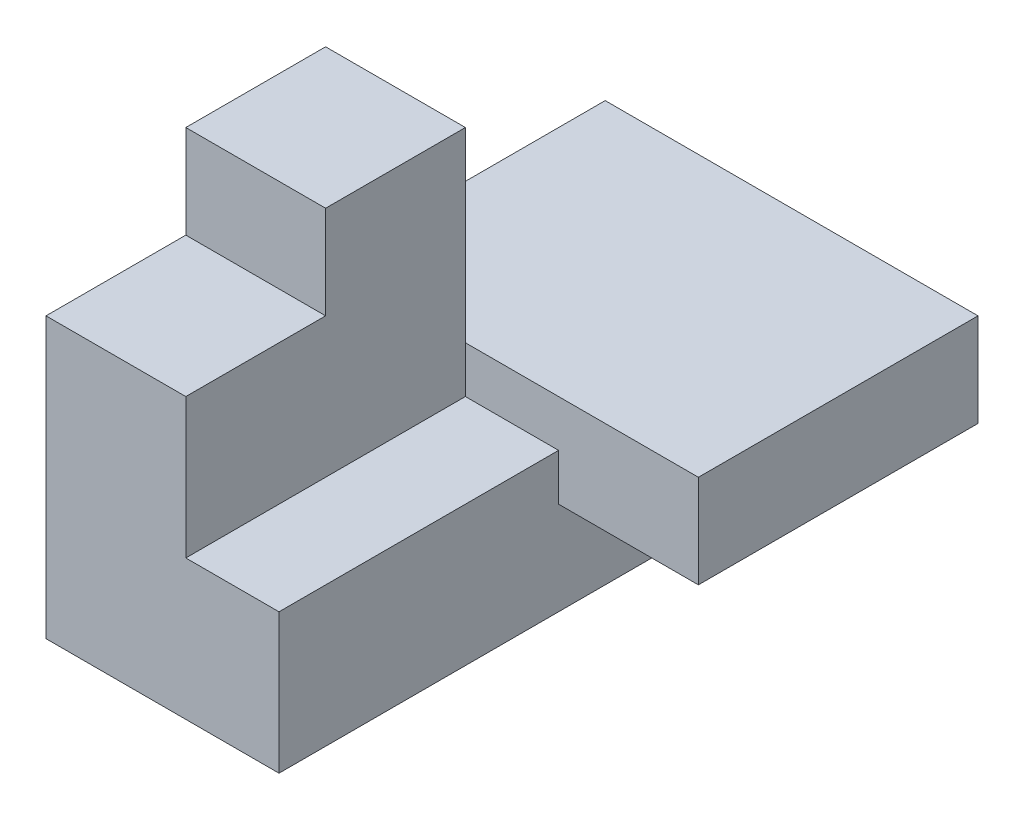
from build123d import *

# Parameters (mm, degrees)
SKETCH1_W           = 40
SKETCH1_H           = 40
BOSS_EXTRUDE1_DEPTH = 60
SKETCH2_W           = 20
SKETCH2_H           = 40
CUT_EXTRUDE1_DEPTH  = 30
SKETCH4_W           = 40
SKETCH4_H           = 30
CUT_EXTRUDE2_DEPTH  = 20
SKETCH5_W           = 30
SKETCH5_H           = 10
CUT_EXTRUDE3_DEPTH  = 15
SKETCH6_W           = 15
SKETCH6_H           = 10
CUT_EXTRUDE4_DEPTH  = 25
SKETCH8_W           = 30
SKETCH8_H           = 15
BOSS_EXTRUDE2_DEPTH = 10
SKETCH10_W          = 30
SKETCH10_H          = 25
CUT_EXTRUDE5_DEPTH  = 5
SKETCH11_W          = 30
SKETCH11_H          = 15
CUT_EXTRUDE6_DEPTH  = 5


with BuildPart() as part:
    # Sketch1 → Boss-Extrude1 (new body)
    with BuildSketch(Plane.XY):
        with Locations((20, 20)):
            Rectangle(SKETCH1_W, SKETCH1_H)
    extrude(amount=BOSS_EXTRUDE1_DEPTH)

    # Sketch2 → Cut-Extrude1 (cut)
    with BuildSketch(Plane.XY.offset(60)):
        with Locations((30, 20)):
            Rectangle(SKETCH2_W, SKETCH2_H)
    extrude(amount=-CUT_EXTRUDE1_DEPTH, mode=Mode.SUBTRACT)

    # Sketch4 → Cut-Extrude2 (cut)
    with BuildSketch(Plane(origin=(0, 40, 0), x_dir=(1, 0, 0), z_dir=(0, 1, 0))):
        with Locations((20, -15)):
            Rectangle(SKETCH4_W, SKETCH4_H)
    extrude(amount=-CUT_EXTRUDE2_DEPTH, mode=Mode.SUBTRACT)

    # Sketch5 → Cut-Extrude3 (cut)
    with BuildSketch(Plane(origin=(40, 0, 0), x_dir=(0, 0, -1), z_dir=(1, 0, 0))):
        with Locations((-15, 5)):
            Rectangle(SKETCH5_W, SKETCH5_H)
    extrude(amount=-CUT_EXTRUDE3_DEPTH, mode=Mode.SUBTRACT)

    # Sketch6 → Cut-Extrude4 (cut)
    with BuildSketch(Plane(origin=(20, 0, 0), x_dir=(0, 0, -1), z_dir=(1, 0, 0))):
        with Locations((-52.5, 35)):
            Rectangle(SKETCH6_W, SKETCH6_H)
    extrude(amount=-CUT_EXTRUDE4_DEPTH, mode=Mode.SUBTRACT)

    # Sketch8 → Boss-Extrude2 (add)
    with BuildSketch(Plane(origin=(20, 0, 0), x_dir=(0, 0, -1), z_dir=(1, 0, 0))):
        with Locations((-45, 7.5)):
            Rectangle(SKETCH8_W, SKETCH8_H)
    extrude(amount=BOSS_EXTRUDE2_DEPTH)

    # Sketch10 → Cut-Extrude5 (cut)
    with BuildSketch(Plane(origin=(20, 0, 0), x_dir=(0, 0, -1), z_dir=(1, 0, 0))):
        with Locations((-45, 27.5)):
            Rectangle(SKETCH10_W, SKETCH10_H)
    extrude(amount=-CUT_EXTRUDE5_DEPTH, mode=Mode.SUBTRACT)

    # Sketch11 → Cut-Extrude6 (cut)
    with BuildSketch(Plane(origin=(30, 0, 0), x_dir=(0, 0, -1), z_dir=(1, 0, 0))):
        with Locations((-45, 7.5)):
            Rectangle(SKETCH11_W, SKETCH11_H)
    extrude(amount=-CUT_EXTRUDE6_DEPTH, mode=Mode.SUBTRACT)


solid = part.part
